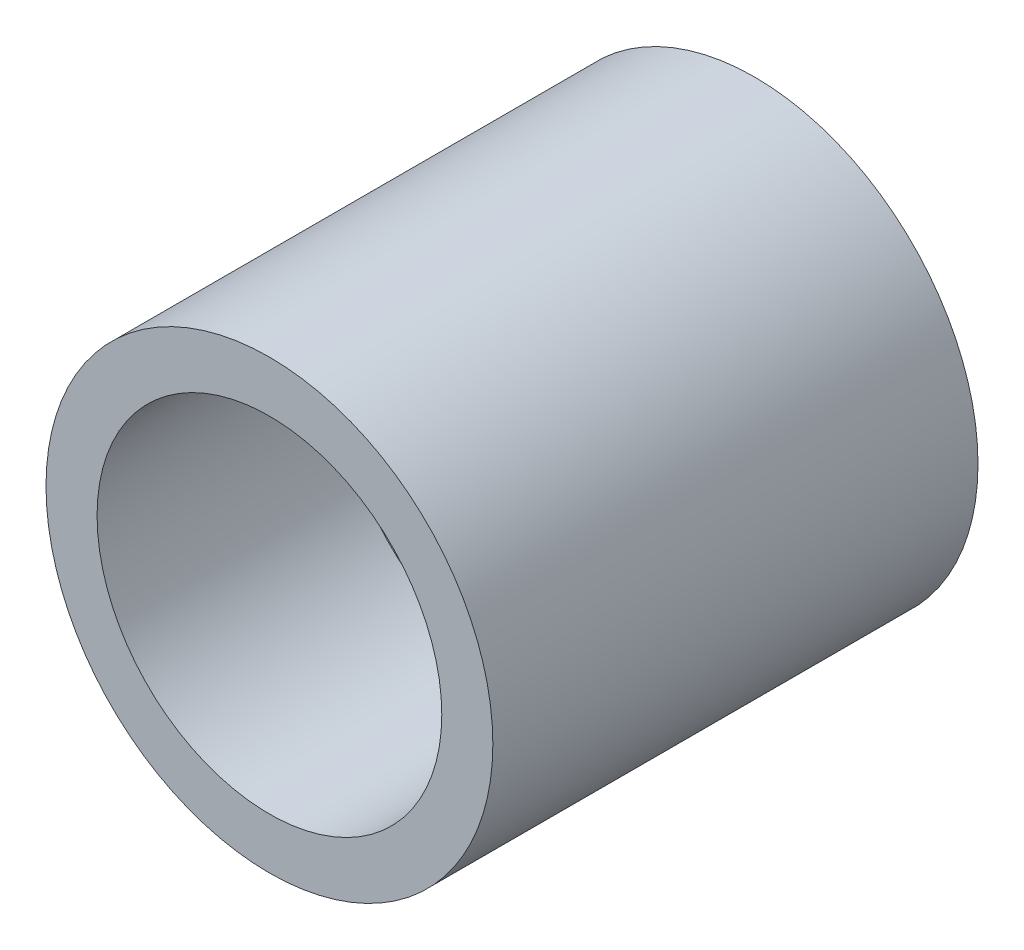
from build123d import *

# Parameters (mm, degrees)
SKETCH1_R                     = 17.5
SKETCH1_R_2                   = 13.5
SKETCH2_R                     = 17.5
PIPE_TAP_DRILL_FOR_3_4_TAP1_D = 23.0124


with BuildPart() as part:
    # Sweep1: sweep along a curve in space
    with BuildLine() as sweep1_path:
        Line((0, 0, 0), (0, 0, -19))
    # Sketch1 → Sweep1 (sweep)
    with BuildSketch(Plane.XY):
        Circle(SKETCH1_R)
        Circle(SKETCH1_R_2, mode=Mode.SUBTRACT)
    sweep(path=sweep1_path.line)

    # Sweep2: sweep along a curve in space
    with BuildLine() as sweep2_path:
        Line((0, 0, -19), (0, 0, -38))
    # Sketch2 → Sweep2 (sweep)
    with BuildSketch(Plane(origin=(0, 0, -19), x_dir=(-1, 0, 0), z_dir=(0, 0, -1))):
        Circle(SKETCH2_R)
    sweep(path=sweep2_path.line)

    # Pipe Tap Drill for 3/4 Tap1 (through all)
    with Locations(Plane(origin=(0, 0, -38), x_dir=(-1, 0, 0), z_dir=(0, 0, -1))):
        with Locations((0, 0)):
            Hole(PIPE_TAP_DRILL_FOR_3_4_TAP1_D / 2)


solid = part.part
